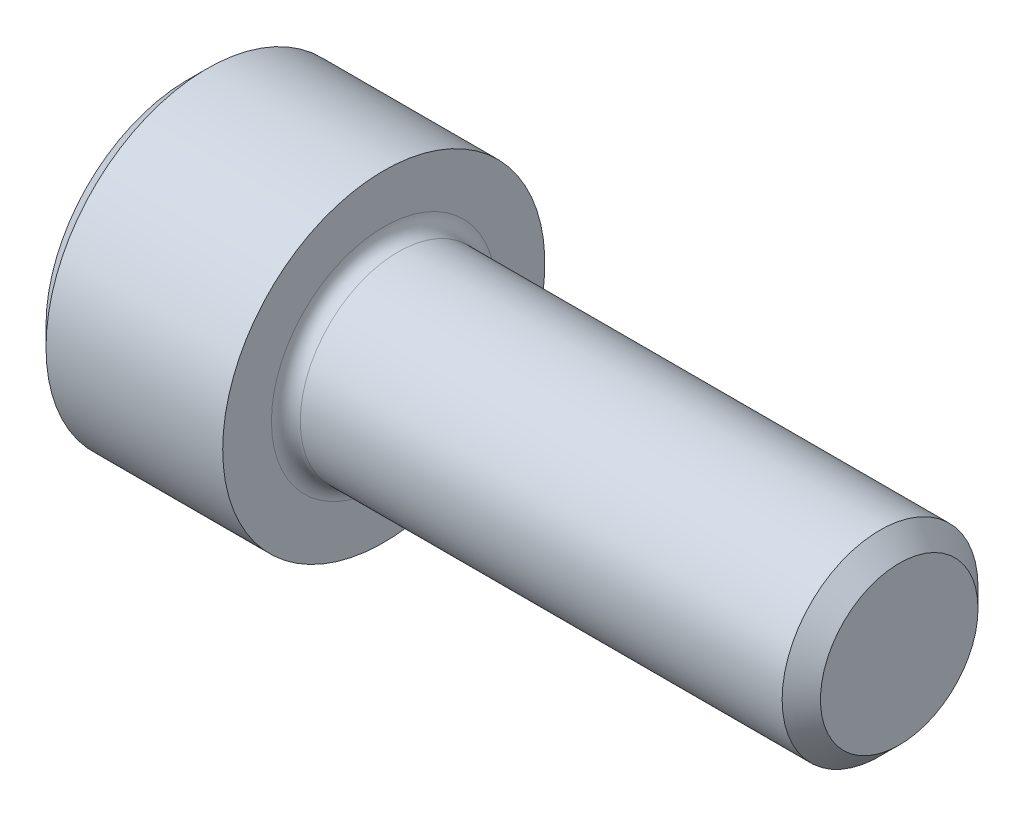
from build123d import *

# Parameters (mm, degrees)
SKETCH1_W           = 4.826
SKETCH1_H           = 3.96875
SKETCH2_R           = 2.413
BOSS_EXTRUDE1_DEPTH = 12.7
CUT_EXTRUDE1_DEPTH  = 2.286
CHAMFER1_SIZE       = 0.47244
FILLET1_R           = 0.3556


with BuildPart() as part:
    # Sketch1 → Revolve1 (revolve)
    with BuildSketch(Plane(origin=(0, 0, 0), x_dir=(-1, 0, 0), z_dir=(0, 0, -1)), mode=Mode.PRIVATE) as revolve1_sk:
        with Locations((-2.413, 1.984375)):
            Rectangle(SKETCH1_W, SKETCH1_H)
    revolve(revolve1_sk.sketch.rotate(Axis((4.826, 0, 0), (-1, 0, 0)), 270), axis=Axis((4.826, 0, 0), (-1, 0, 0)))

    # Sketch2 → Boss-Extrude1 (add)
    with BuildSketch(Plane(origin=(4.826, 0, 0), x_dir=(0, 0, -1), z_dir=(1, 0, 0))):
        Circle(SKETCH2_R)
    extrude(amount=BOSS_EXTRUDE1_DEPTH)

    # Sketch3 → Cut-Extrude1 (cut)
    with BuildSketch(Plane.ZY):
        Polygon((0, -2.292092116), (1.98501, -1.146046058), (1.98501, 1.146046058), (0, 2.292092116), (-1.98501, 1.146046058), (-1.98501, -1.146046058), align=None)
    extrude(amount=-CUT_EXTRUDE1_DEPTH, mode=Mode.SUBTRACT)

    # Sketch4 → Cut-Revolve1 (revolve, cut)
    with BuildSketch(Plane.XY, mode=Mode.PRIVATE) as cut_revolve1_sk:
        Polygon((2.286, 1.98501), (2.286, 0), (3.432046058, 0), align=None)
    revolve(cut_revolve1_sk.sketch.rotate(Axis((2.286, 0, 0), (1, 0, 0)), 90), axis=Axis((2.286, 0, 0), (1, 0, 0)), mode=Mode.SUBTRACT)

    # Chamfer1
    chamfer1_edges = [part.edges().sort_by_distance(p)[0] for p in [
        (0, 0, -3.96875),
        (17.526, 0, 2.413),
    ]]
    chamfer(chamfer1_edges, length=CHAMFER1_SIZE)

    # Fillet1
    fillet1_edges = [part.edges().sort_by_distance(p)[0] for p in [
        (4.826, 0, 2.413),
    ]]
    fillet(fillet1_edges, radius=FILLET1_R)


solid = part.part
